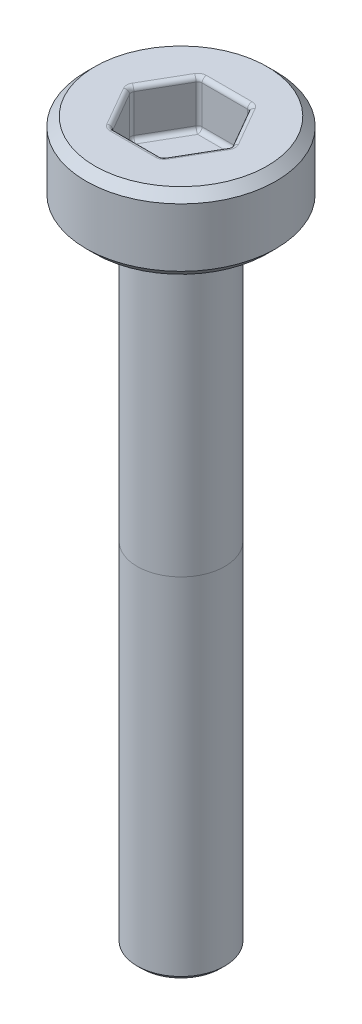
from build123d import *

# Parameters (mm, degrees)
SKETCH1_R           = 0.75
BOSS_EXTRUDE1_DEPTH = 11
SKETCH2_R           = 1.625
BOSS_EXTRUDE2_DEPTH = 1.3
FILLET1_R           = 0.15
CHAMFER1_SIZE       = 0.15
CUT_EXTRUDE1_DEPTH  = 0.8
CHAMFER2_SIZE       = 0.075
FILLET2_R           = 0.075


with BuildPart() as part:
    # Sketch1 → Boss-Extrude1 (new body)
    with BuildSketch(Plane(origin=(0, 0, 0), x_dir=(1, 0, 0), z_dir=(0, 1, 0))):
        with Locations(Location((0, 0, 0), (0, 0, 270))):
            Circle(SKETCH1_R)
    extrude(amount=BOSS_EXTRUDE1_DEPTH)

    # Sketch2 → Boss-Extrude2 (add)
    with BuildSketch(Plane(origin=(0, 11, 0), x_dir=(1, 0, 0), z_dir=(0, 1, 0))):
        with Locations(Location((0, 0, 0), (0, 0, 270))):
            Circle(SKETCH2_R)
    extrude(amount=BOSS_EXTRUDE2_DEPTH)

    # Fillet1
    fillet1_edges = [part.edges().sort_by_distance(p)[0] for p in [
        (0, 11, -0.75),
    ]]
    fillet(fillet1_edges, radius=FILLET1_R)

    # Chamfer1
    chamfer1_edges = [part.edges().sort_by_distance(p)[0] for p in [
        (0, 11, -1.625),
        (0, 12.3, -1.625),
    ]]
    chamfer(chamfer1_edges, length=CHAMFER1_SIZE)

    # Sketch3 → Cut-Extrude1 (cut)
    with BuildSketch(Plane(origin=(0, 12.3, 0), x_dir=(1, 0, 0), z_dir=(0, 1, 0))):
        Polygon((-0.433012702, 0.75), (-0.866025404, 0), (-0.433012702, -0.75), (0.433012702, -0.75), (0.866025404, 0), (0.433012702, 0.75), align=None)
    extrude(amount=-CUT_EXTRUDE1_DEPTH, mode=Mode.SUBTRACT)

    # Chamfer2
    chamfer2_edges = [part.edges().sort_by_distance(p)[0] for p in [
        (0, 0, -0.75),
    ]]
    chamfer(chamfer2_edges, length=CHAMFER2_SIZE)

    # Fillet2
    fillet2_edges = [part.edges().sort_by_distance(p)[0] for p in [
        (0, 11.5, -0.75),
        (-0.433012702, 11.9, -0.75),
        (0.649519053, 11.5, -0.375),
        (0.433012702, 11.9, -0.75),
        (0.649519053, 11.5, 0.375),
        (0.866025404, 11.9, 0),
        (0, 11.5, 0.75),
        (0.433012702, 11.9, 0.75),
        (-0.649519053, 11.5, 0.375),
        (-0.433012702, 11.9, 0.75),
        (-0.649519053, 11.5, -0.375),
        (-0.866025404, 11.9, 0),
        (0, 12.3, -0.75),
        (-0.649519053, 12.3, -0.375),
        (-0.649519053, 12.3, 0.375),
        (0, 12.3, 0.75),
        (0.649519053, 12.3, 0.375),
        (0.649519053, 12.3, -0.375),
    ]]
    fillet(fillet2_edges, radius=FILLET2_R)


solid = part.part
